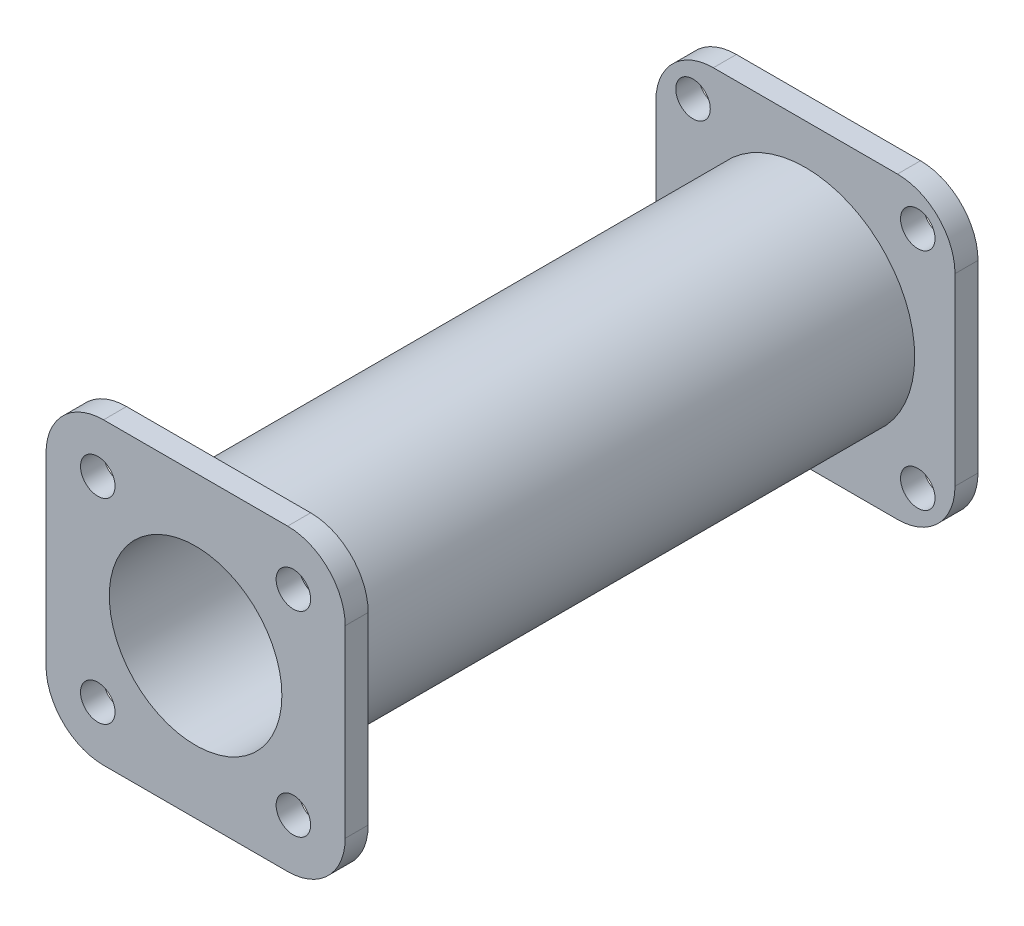
from build123d import *

# Parameters (mm, degrees)
SKETCH_1_R      = 1.5
SKETCH_1_R_2    = 9.5
EXTRUDE_1_DEPTH = 2
SKETCH_1_6_R    = 9.5
SKETCH_1_6_R_2  = 7.5
EXTRUDE_2_DEPTH = 55
EXTRUDE_START   = -2
SKETCH_5_R      = 1.5
SKETCH_5_R_2    = 9.5
EXTRUDE_3_DEPTH = 2


with BuildPart() as part:
    # 草图1 → 凸台-拉伸1 (new body)
    with BuildSketch(Plane.XY):
        with BuildLine():
            Line((8, 13), (-8, 13))
            ThreePointArc((-8, 13), (-11.535533906, 11.535533906), (-13, 8))
            Line((-13, 8), (-13, -8))
            ThreePointArc((-13, -8), (-11.535533906, -11.535533906), (-8, -13))
            Line((-8, -13), (8, -13))
            ThreePointArc((8, -13), (11.535533906, -11.535533906), (13, -8))
            Line((13, -8), (13, 8))
            ThreePointArc((13, 8), (11.535533906, 11.535533906), (8, 13))
        make_face()
        with Locations((-9.767766953, -9.767766953)):
            Circle(SKETCH_1_R, mode=Mode.SUBTRACT)
        with Locations((9.767766953, -9.767766953)):
            Circle(SKETCH_1_R, mode=Mode.SUBTRACT)
        with Locations((-9.767766953, 9.767766953)):
            Circle(SKETCH_1_R, mode=Mode.SUBTRACT)
        Circle(SKETCH_1_R_2, mode=Mode.SUBTRACT)
        with Locations((9.767766953, 9.767766953)):
            Circle(SKETCH_1_R, mode=Mode.SUBTRACT)
    extrude(amount=EXTRUDE_1_DEPTH)

    # 草图1<6> → 凸台-拉伸2 (add)
    with BuildSketch(Plane.XY):
        Circle(SKETCH_1_6_R)
        Circle(SKETCH_1_6_R_2, mode=Mode.SUBTRACT)
    extrude(amount=EXTRUDE_2_DEPTH)

    # 草图5 → 凸台-拉伸3 (add)
    with BuildSketch(Plane.XY.offset(55).offset(EXTRUDE_START)):
        with BuildLine():
            Line((8, 13), (-8, 13))
            ThreePointArc((-8, 13), (-11.535533906, 11.535533906), (-13, 8))
            Line((-13, 8), (-13, -8))
            ThreePointArc((-13, -8), (-11.535533906, -11.535533906), (-8, -13))
            Line((-8, -13), (8, -13))
            ThreePointArc((8, -13), (11.535533906, -11.535533906), (13, -8))
            Line((13, -8), (13, 8))
            ThreePointArc((13, 8), (11.535533906, 11.535533906), (8, 13))
        make_face()
        with Locations((-8.5, -8.5)):
            Circle(SKETCH_5_R, mode=Mode.SUBTRACT)
        with Locations((8.5, -8.5)):
            Circle(SKETCH_5_R, mode=Mode.SUBTRACT)
        Circle(SKETCH_5_R_2, mode=Mode.SUBTRACT)
        with Locations((-8.5, 8.5)):
            Circle(SKETCH_5_R, mode=Mode.SUBTRACT)
        with Locations((8.5, 8.5)):
            Circle(SKETCH_5_R, mode=Mode.SUBTRACT)
    extrude(amount=EXTRUDE_3_DEPTH)


solid = part.part
